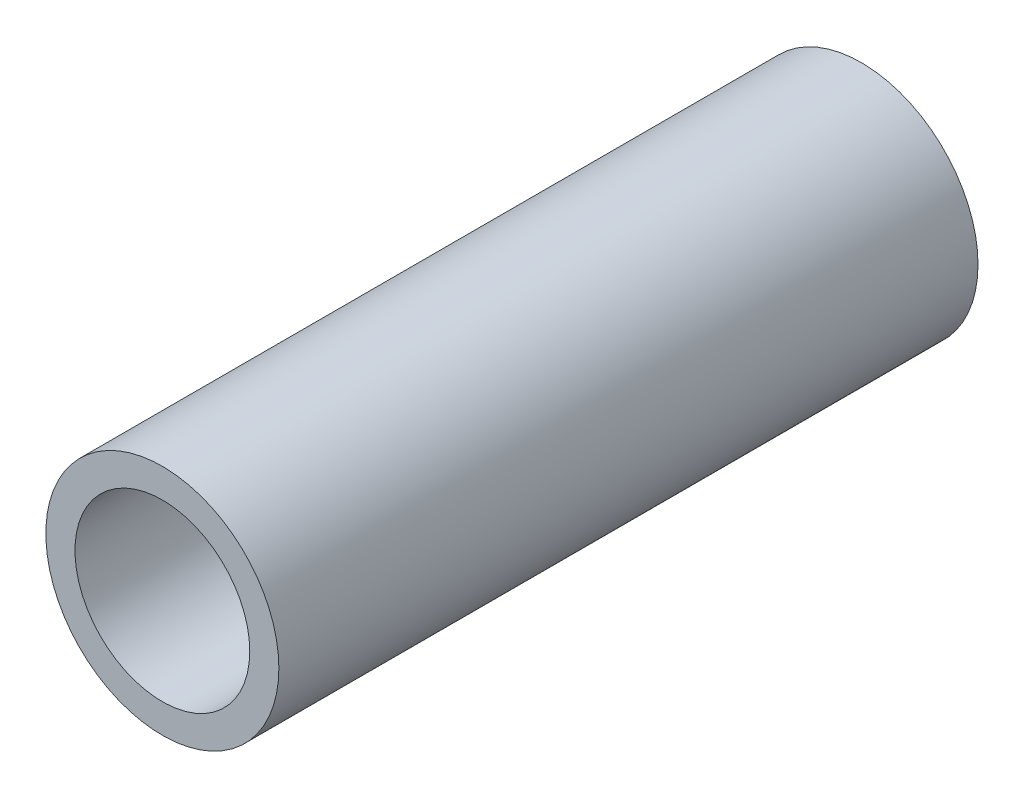
from build123d import *

# Parameters (mm, degrees)
SKETCH1_R           = 4
SKETCH1_R_2         = 3
BOSS_EXTRUDE1_DEPTH = 24


with BuildPart() as part:
    # Sketch1 → Boss-Extrude1 (new body)
    with BuildSketch(Plane.XY):
        Circle(SKETCH1_R)
        Circle(SKETCH1_R_2, mode=Mode.SUBTRACT)
    extrude(amount=BOSS_EXTRUDE1_DEPTH)


solid = part.part
